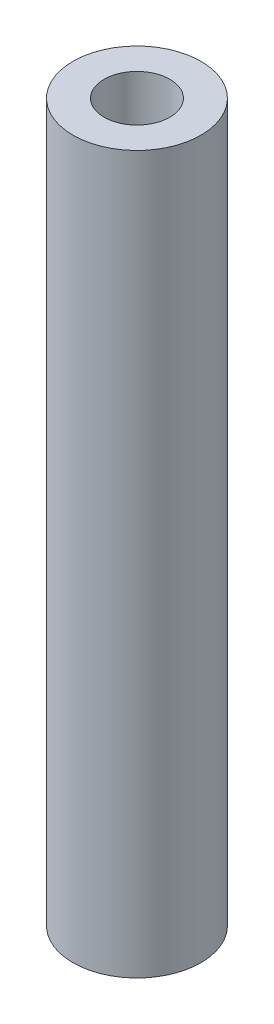
from build123d import *

# Parameters (mm, degrees)
SKETCH1_R           = 3.175
BOSS_EXTRUDE1_DEPTH = 35.56
SKETCH2_R           = 1.63195
CUT_EXTRUDE1_DEPTH  = 36.842361111


with BuildPart() as part:
    # Sketch1 → Boss-Extrude1 (new body)
    with BuildSketch(Plane(origin=(0, 0, 0), x_dir=(1, 0, 0), z_dir=(0, 1, 0))):
        with Locations(Location((0, 0, 0), (0, 0, 270))):
            Circle(SKETCH1_R)
    extrude(amount=BOSS_EXTRUDE1_DEPTH)

    # Sketch2 → Cut-Extrude1 (cut, through all)
    with BuildSketch(Plane(origin=(0, 35.56, 0), x_dir=(1, 0, 0), z_dir=(0, 1, 0))):
        with Locations(Location((0, 0, 0), (0, 0, 270))):
            Circle(SKETCH2_R)
    extrude(amount=-CUT_EXTRUDE1_DEPTH, mode=Mode.SUBTRACT)


solid = part.part
